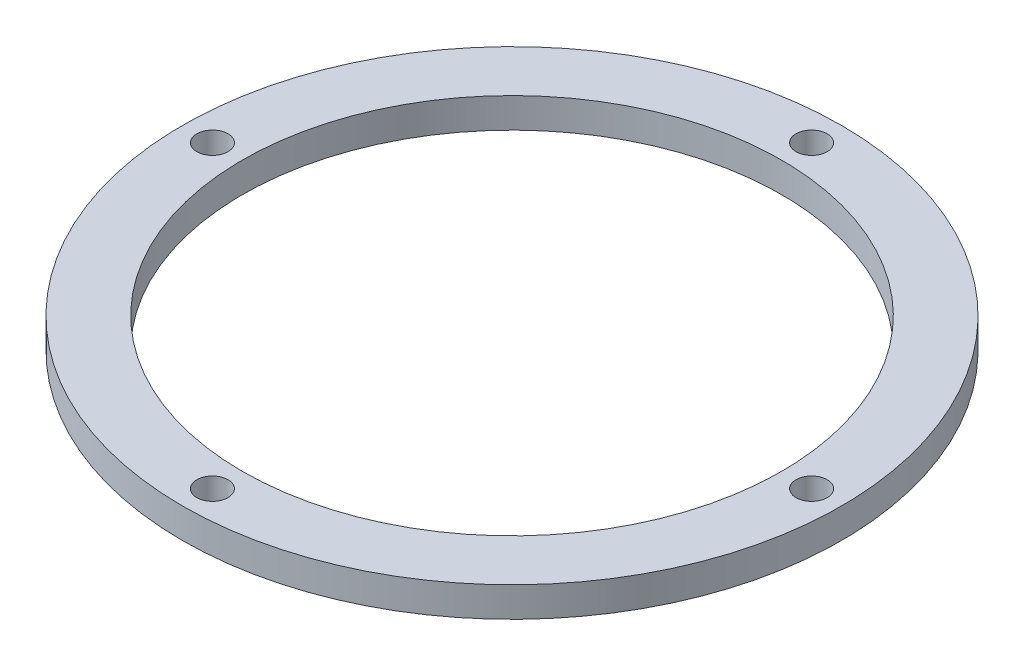
from build123d import *

# Parameters (mm, degrees)
SKETCH1_R           = 55
SKETCH1_R_2         = 45
SKETCH1_R_3         = 2.6
BOSS_EXTRUDE1_DEPTH = 5


with BuildPart() as part:
    # Sketch1 → Boss-Extrude1 (new body)
    with BuildSketch(Plane(origin=(0, 0, 0), x_dir=(1, 0, 0), z_dir=(0, 1, 0))):
        with Locations(Location((0, 0, 0), (0, 0, 270))):
            Circle(SKETCH1_R)
        with Locations(Location((0, 0, 0), (0, 0, 270))):
            Circle(SKETCH1_R_2, mode=Mode.SUBTRACT)
        with Locations(Location((0, 50, 0), (0, 0, 270))):
            Circle(SKETCH1_R_3, mode=Mode.SUBTRACT)
        with Locations(Location((50, 0, 0), (0, 0, 270))):
            Circle(SKETCH1_R_3, mode=Mode.SUBTRACT)
        with Locations(Location((0, -50, 0), (0, 0, 270))):
            Circle(SKETCH1_R_3, mode=Mode.SUBTRACT)
        with Locations(Location((-50, 0, 0), (0, 0, 270))):
            Circle(SKETCH1_R_3, mode=Mode.SUBTRACT)
    extrude(amount=BOSS_EXTRUDE1_DEPTH)


solid = part.part
